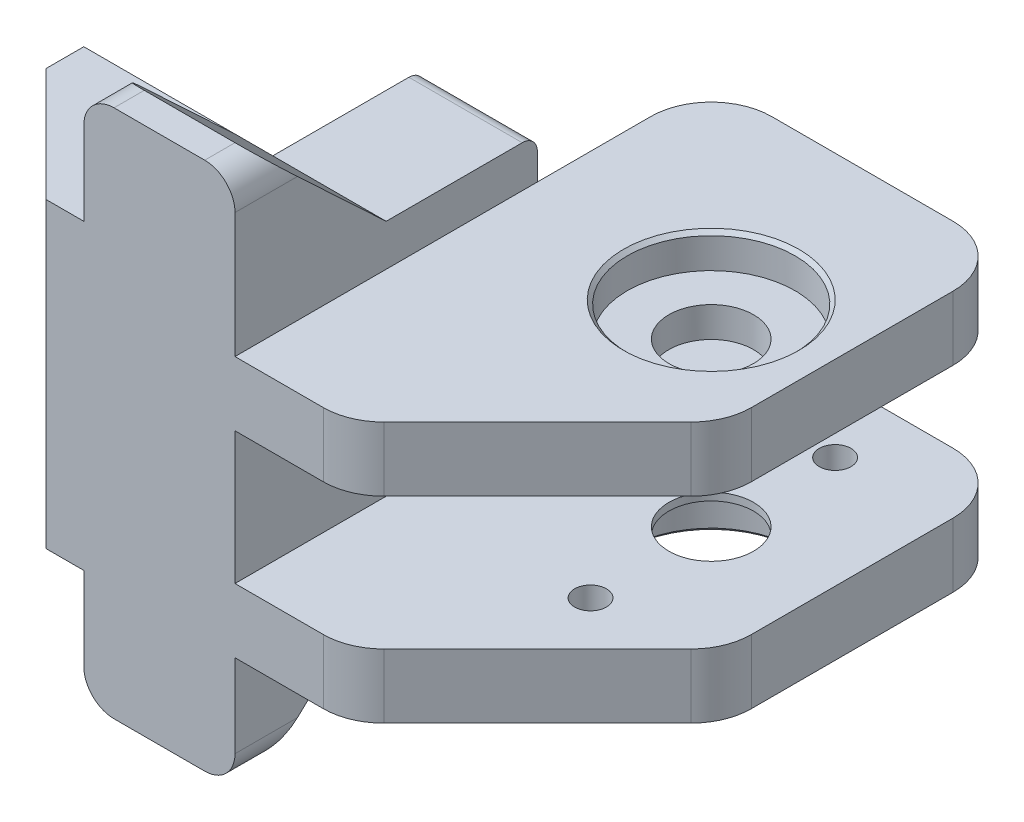
from build123d import *

# Parameters (mm, degrees)
SKETCH1_W                = 40
SKETCH1_H                = 40
BOSS_EXTRUDE1_DEPTH      = 40
SKETCH2_W                = 25
SKETCH2_H                = 20
CUT_EXTRUDE1_DEPTH       = 40
CHAMFER1_SIZE            = 15
CUT_EXTRUDE2_DEPTH       = 15
CHAMFER2_SIZE            = 4
SKETCH4_R                = 2.6
CUT_EXTRUDE3_DEPTH       = 17
BOSS_EXTRUDE2_DEPTH      = 8
BOSS_EXTRUDE2_DEPTH_BACK = 40
SKETCH5_W                = 40
SKETCH5_H                = 8.5
SKETCH10_W               = 14
SKETCH10_H               = 10
CUT_EXTRUDE5_DEPTH       = 26
SKETCH8_R                = 5.6
CUT_EXTRUDE4_DEPTH       = 34
BOSS_EXTRUDE3_DEPTH      = 20
FILLET3_R                = 4
FILLET4_R                = 2
CHAMFER7_SIZE            = 25
CHAMFER8_SIZE            = 2
CHAMFER8_SIZE2           = 10
FILLET7_R                = 2
SKETCH14_W               = 40
SKETCH14_H               = 8.5
BOSS_EXTRUDE4_DEPTH      = 15
SKETCH16_W               = 40
SKETCH16_H               = 8.5
BOSS_EXTRUDE5_DEPTH      = 15
SKETCH12_R               = 11.1
CUT_EXTRUDE6_DEPTH       = 4.5
CUT_EXTRUDE7_START       = -7.5
SKETCH13_R               = 11.1
CUT_EXTRUDE7_DEPTH       = 7.5
SKETCH15_R               = 2.1
CUT_EXTRUDE8_DEPTH       = 10
CHAMFER10_SIZE           = 0.5
FILLET8_R                = 8


with BuildPart() as part:
    # Sketch1 → Boss-Extrude1 (new body)
    with BuildSketch(Plane(origin=(0, 0, 0), x_dir=(1, 0, 0), z_dir=(0, 1, 0))):
        with Locations((20, 20)):
            Rectangle(SKETCH1_W, SKETCH1_H)
    extrude(amount=BOSS_EXTRUDE1_DEPTH)

    # Sketch2 → Cut-Extrude1 (cut)
    with BuildSketch(Plane(origin=(0, 40, 0), x_dir=(1, 0, 0), z_dir=(0, 1, 0))):
        with Locations((12.5, 30)):
            Rectangle(SKETCH2_W, SKETCH2_H)
    extrude(amount=-CUT_EXTRUDE1_DEPTH, mode=Mode.SUBTRACT)

    # Chamfer1
    chamfer1_edges = [part.edges().sort_by_distance(p)[0] for p in [
        (0, 20, 0),
    ]]
    chamfer(chamfer1_edges, length=CHAMFER1_SIZE)

    # Sketch3 → Cut-Extrude2 (cut)
    with BuildSketch(Plane.XY):
        Polygon((0, 10), (0, 15), (15, 15), (15, 5), (0, 5), align=None)
        Polygon((0, 30), (0, 25), (15, 25), (15, 35), (0, 35), align=None)
    extrude(amount=-CUT_EXTRUDE2_DEPTH, mode=Mode.SUBTRACT)

    # Chamfer2
    chamfer2_edges = [part.edges().sort_by_distance(p)[0] for p in [
        (15, 35, -7.5),
        (15, 25, -7.5),
        (15, 15, -7.5),
        (15, 5, -7.5),
    ]]
    chamfer(chamfer2_edges, length=CHAMFER2_SIZE)

    # Sketch4 → Cut-Extrude3 (cut)
    with BuildSketch(Plane.XY.offset(-15)):
        with Locations((8, 30)):
            Circle(SKETCH4_R)
        with Locations((8, 10)):
            Circle(SKETCH4_R)
    extrude(amount=-CUT_EXTRUDE3_DEPTH, mode=Mode.SUBTRACT)

    # Sketch5 → Boss-Extrude2 (add, two sides: drawn at the far end of the back side and taken through both)
    with BuildSketch(Plane(origin=(0, 0, -40), x_dir=(-1, 0, 0), z_dir=(0, 0, -1)).offset(-BOSS_EXTRUDE2_DEPTH_BACK)):
        with Locations((-60, 4.25)):
            Rectangle(SKETCH5_W, SKETCH5_H)
        with Locations((-60, 30.25)):
            Rectangle(SKETCH5_W, SKETCH5_H)
    extrude(amount=BOSS_EXTRUDE2_DEPTH + BOSS_EXTRUDE2_DEPTH_BACK)

    # Sketch10 → Cut-Extrude5 (cut)
    with BuildSketch(Plane(origin=(40, 0, 0), x_dir=(0, 0, -1), z_dir=(1, 0, 0))):
        with Locations((29, 20)):
            Rectangle(SKETCH10_W, SKETCH10_H)
    extrude(amount=-CUT_EXTRUDE5_DEPTH, mode=Mode.SUBTRACT)

    # Sketch8 → Cut-Extrude4 (cut)
    with BuildSketch(Plane(origin=(0, 32, 0), x_dir=(1, 0, 0), z_dir=(0, 1, 0))):
        with Locations(Location((65, 38, 0), (0, 0, 270))):
            Circle(SKETCH8_R)
    extrude(amount=-CUT_EXTRUDE4_DEPTH, mode=Mode.SUBTRACT)

    # Sketch9 → Boss-Extrude3 (add)
    with BuildSketch(Plane(origin=(40, 0, 0), x_dir=(0, 0, -1), z_dir=(1, 0, 0))):
        Polygon((0, 40), (0, 55), (4, 55), (20, 40), align=None)
        Polygon((0, 0), (0, -15), (4, -15), (20, 0), align=None)
    extrude(amount=-BOSS_EXTRUDE3_DEPTH)

    # Fillet3
    fillet3_edges = [part.edges().sort_by_distance(p)[0] for p in [
        (20, 55, -2),
        (40, 55, -2),
        (20, -15, -2),
        (40, -15, -2),
    ]]
    fillet(fillet3_edges, radius=FILLET3_R)

    # Fillet4
    fillet4_edges = [part.edges().sort_by_distance(p)[0] for p in [
        (32.5, 40, -40),
        (32.5, 0, -40),
    ]]
    fillet(fillet4_edges, radius=FILLET4_R)

    # Chamfer7
    chamfer7_edges = [part.edges().sort_by_distance(p)[0] for p in [
        (80, 4.25, 0),
        (80, 30.25, 0),
    ]]
    chamfer(chamfer7_edges, length=CHAMFER7_SIZE)

    # Chamfer8
    chamfer8_edges = [part.edges().sort_by_distance(p)[0] for p in [
        (40, 20, -36),
    ]]
    chamfer8_side = [part.faces().sort_by_distance(p)[0] for p in [
        (40, 16.5625, -17.75),
    ]]
    chamfer(chamfer8_edges, length=CHAMFER8_SIZE, length2=CHAMFER8_SIZE2, reference=chamfer8_side[0])

    # Fillet7
    fillet7_edges = [part.edges().sort_by_distance(p)[0] for p in [
        (27.5, 15, -36),
        (32.5, 15, -22),
        (32.5, 25, -22),
        (27.5, 25, -36),
        (35, 25, -37),
        (35, 15, -37),
    ]]
    fillet(fillet7_edges, radius=FILLET7_R)

    # Sketch14 → Boss-Extrude4 (add)
    with BuildSketch(Plane(origin=(0, 0, -48), x_dir=(-1, 0, 0), z_dir=(0, 0, -1))):
        with Locations((-60, 4.25)):
            Rectangle(SKETCH14_W, SKETCH14_H)
    extrude(amount=BOSS_EXTRUDE4_DEPTH)

    # Sketch16 → Boss-Extrude5 (add)
    with BuildSketch(Plane(origin=(0, 0, -48), x_dir=(-1, 0, 0), z_dir=(0, 0, -1))):
        with Locations((-60, 30.25)):
            Rectangle(SKETCH16_W, SKETCH16_H)
    extrude(amount=BOSS_EXTRUDE5_DEPTH)

    # Sketch12 → Cut-Extrude6 (cut)
    with BuildSketch(Plane(origin=(0, 34.5, 0), x_dir=(1, 0, 0), z_dir=(0, 1, 0))):
        with Locations(Location((65, 38, 0), (0, 0, 180))):
            Circle(SKETCH12_R)
    extrude(amount=-CUT_EXTRUDE6_DEPTH, mode=Mode.SUBTRACT)

    # Sketch13 → Cut-Extrude7 (cut)
    with BuildSketch(Plane.XZ.offset(CUT_EXTRUDE7_START)):
        with Locations(Location((65, -38, 0), (0, 0, 180))):
            Circle(SKETCH13_R)
    extrude(amount=CUT_EXTRUDE7_DEPTH, mode=Mode.SUBTRACT)

    # Sketch15 → Cut-Extrude8 (cut)
    with BuildSketch(Plane.XZ):
        with Locations(Location((65.260929409, -54.130501699, 0), (0, 0, 270))):
            Circle(SKETCH15_R)
        with Locations(Location((65.16900186, -21.868239994, 0), (0, 0, 270))):
            Circle(SKETCH15_R)
    extrude(amount=-CUT_EXTRUDE8_DEPTH, mode=Mode.SUBTRACT)

    # Chamfer10
    chamfer10_edges = [part.edges().sort_by_distance(p)[0] for p in [
        (76.1, 34.5, -38),
        (76.1, 0, -38),
    ]]
    chamfer(chamfer10_edges, length=CHAMFER10_SIZE)

    # Fillet8
    fillet8_edges = [part.edges().sort_by_distance(p)[0] for p in [
        (55, 30.25, 0),
        (55, 4.25, 0),
        (80, 4.25, -25),
        (80, 30.25, -25),
        (80, 4.25, -63),
        (40, 4.25, -63),
        (80, 30.25, -63),
        (40, 30.25, -63),
    ]]
    fillet(fillet8_edges, radius=FILLET8_R)


solid = part.part
